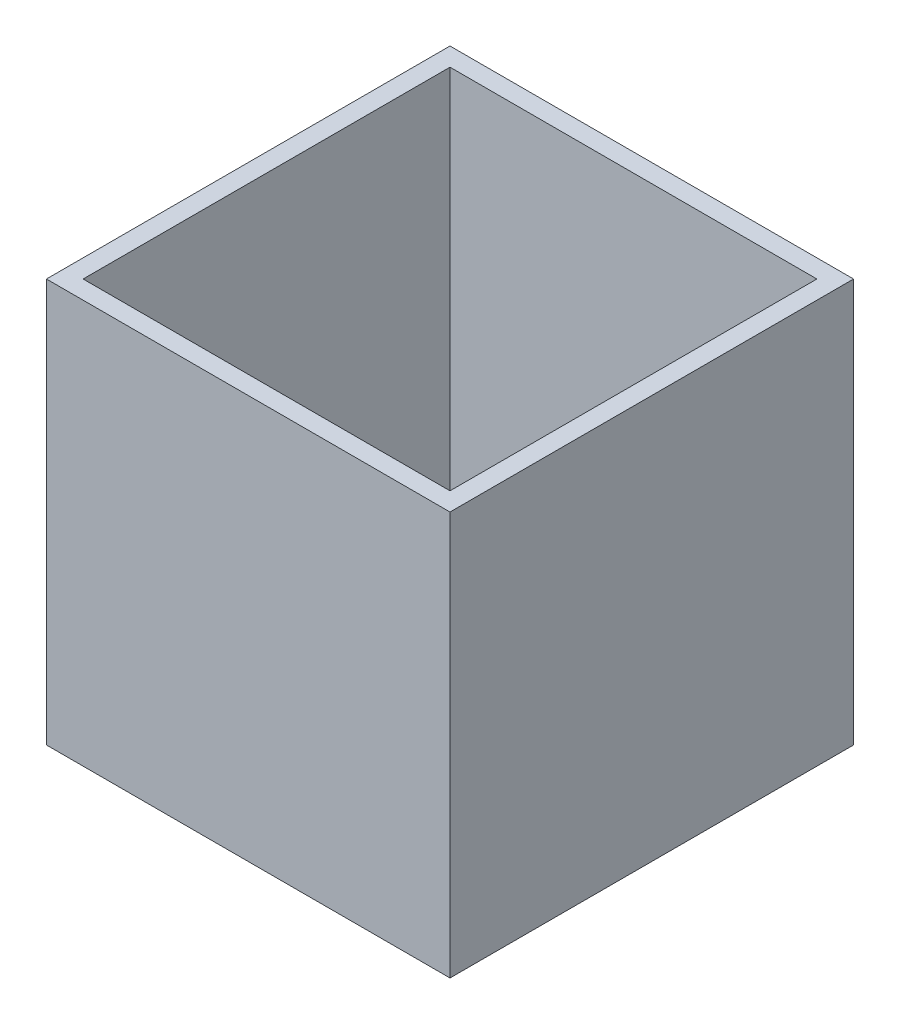
from build123d import *

# Parameters (mm, degrees)
SKETCH1_W           = 55.88
SKETCH1_H           = 55.88
BOSS_EXTRUDE1_DEPTH = 55.88
SHELL1_T            = -2.54


with BuildPart() as part:
    # Sketch1 → Boss-Extrude1 (new body)
    with BuildSketch(Plane(origin=(0, 0, 0), x_dir=(0, 0, -1), z_dir=(1, 0, 0))):
        Rectangle(SKETCH1_W, SKETCH1_H)
    extrude(amount=BOSS_EXTRUDE1_DEPTH)

    # Shell1
    shell1_openings = [part.faces().sort_by_distance(p)[0] for p in [
        (27.94, 27.94, 0),
    ]]
    offset(amount=SHELL1_T, openings=shell1_openings, kind=Kind.INTERSECTION)


solid = part.part
